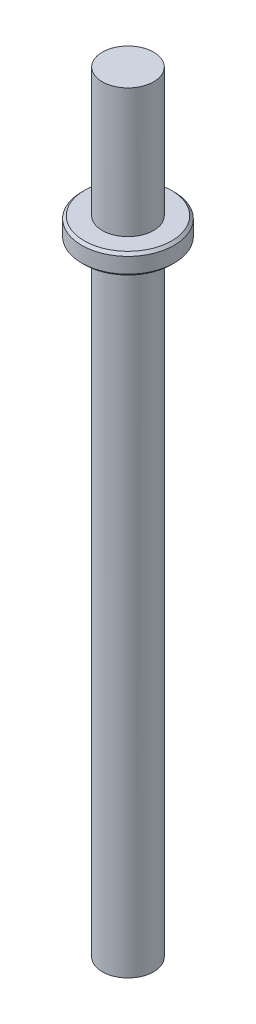
from build123d import *

# Parameters (mm, degrees)
SKETCH1_W           = 10
SKETCH1_H           = 300
BOSS_EXTRUDE3_START = 8
SKETCH4_R           = 18
SKETCH4_R_2         = 10
BOSS_EXTRUDE3_DEPTH = 8
CHAMFER1_SIZE       = 1


with BuildPart() as part:
    # Sketch1 → Revolve1 (revolve)
    with BuildSketch(Plane.XY):
        with Locations((-7.916666667, -11.875)):
            Rectangle(SKETCH1_W, SKETCH1_H)
    revolve(axis=Axis((-2.916666667, 138.125, 0), (0, -1, 0)))

    # Sketch4 → Boss-Extrude3 (add)
    with BuildSketch(Plane(origin=(0, 80, 0), x_dir=(1, 0, 0), z_dir=(0, 1, 0)).offset(BOSS_EXTRUDE3_START)):
        with Locations(Location((-2.916666667, 0, 0), (0, 0, 270))):
            Circle(SKETCH4_R)
        with Locations(Location((-2.916666667, 0, 0), (0, 0, 180))):
            Circle(SKETCH4_R_2, mode=Mode.SUBTRACT)
    extrude(amount=-BOSS_EXTRUDE3_DEPTH)

    # Chamfer1
    chamfer1_edges = [part.edges().sort_by_distance(p)[0] for p in [
        (-2.916666667, 88, -18),
        (-2.916666667, 80, -18),
    ]]
    chamfer(chamfer1_edges, length=CHAMFER1_SIZE)


solid = part.part
